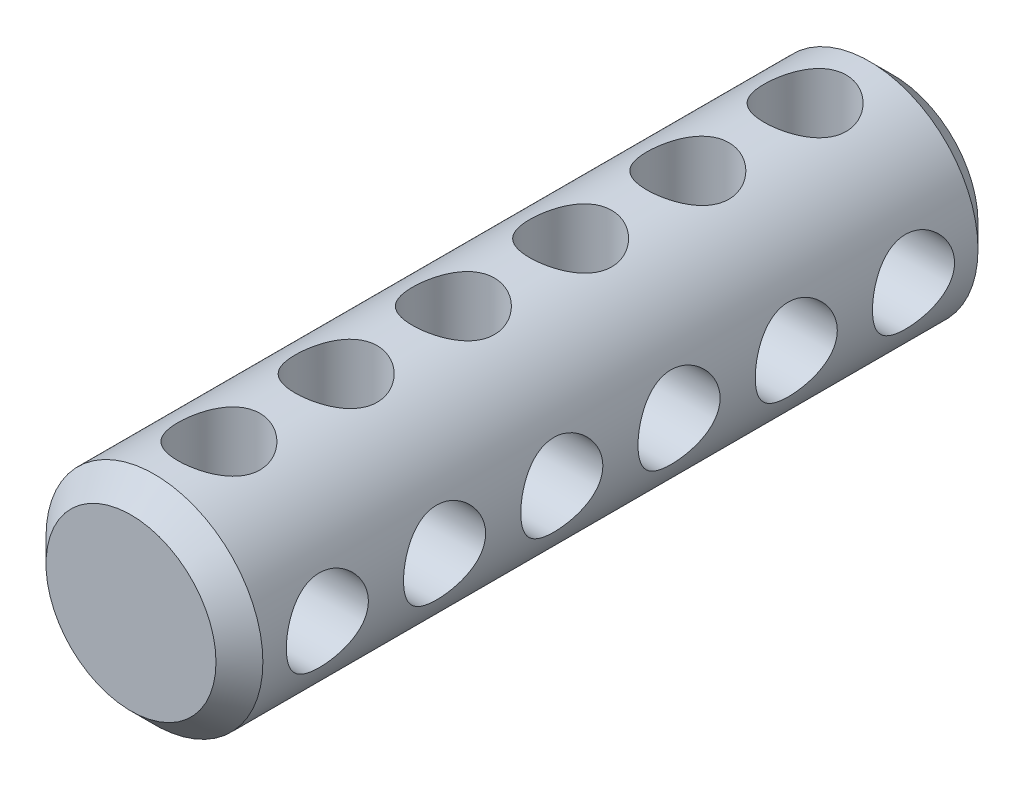
from build123d import *

# Parameters (mm, degrees)
SKETCH_1_R               = 9.25
EXTRUDE_1_DEPTH          = 65
CHAMFER_1_SIZE           = 2
SKETCH_2_R               = 3.5
CUT_EXTRUDE_1_DEPTH      = 65
PATTERN_CIRCULAR_1_COUNT = 2
PATTERN_CIRCULAR_1_ANGLE = 90


with BuildPart() as part:
    # Эскиз1 → Бобышка-Вытянуть1 (new body)
    with BuildSketch(Plane.XY):
        Circle(SKETCH_1_R)
    extrude(amount=EXTRUDE_1_DEPTH)

    # Фаска1
    chamfer_1_edges = [part.edges().sort_by_distance(p)[0] for p in [
        (-9.25, 0, 0),
        (-9.25, 0, 65),
    ]]
    chamfer(chamfer_1_edges, length=CHAMFER_1_SIZE)

    # Эскиз2 → Вырез-Вытянуть1 (cut, symmetric)
    with BuildSketch(Plane(origin=(0, 0, 0), x_dir=(1, 0, 0), z_dir=(0, 1, 0))):
        with Locations((0, -7.5)):
            Circle(SKETCH_2_R)
        with Locations((0, -17.5)):
            Circle(SKETCH_2_R)
        with Locations((0, -27.5)):
            Circle(SKETCH_2_R)
        with Locations((0, -37.5)):
            Circle(SKETCH_2_R)
        with Locations((0, -47.5)):
            Circle(SKETCH_2_R)
        with Locations((0, -57.5)):
            Circle(SKETCH_2_R)
    cut_extrude_1 = extrude(amount=CUT_EXTRUDE_1_DEPTH, both=True, mode=Mode.SUBTRACT)

    # Круговой массив1: Вырез-Вытянуть1 ×2 about axis
    pattern_circular_1_axis = Axis((0, 0, 65), (0, 0, -1))
    for i in range(1, PATTERN_CIRCULAR_1_COUNT):
        add(cut_extrude_1.rotate(pattern_circular_1_axis, i * PATTERN_CIRCULAR_1_ANGLE / (PATTERN_CIRCULAR_1_COUNT - 1)), mode=Mode.SUBTRACT)


solid = part.part
